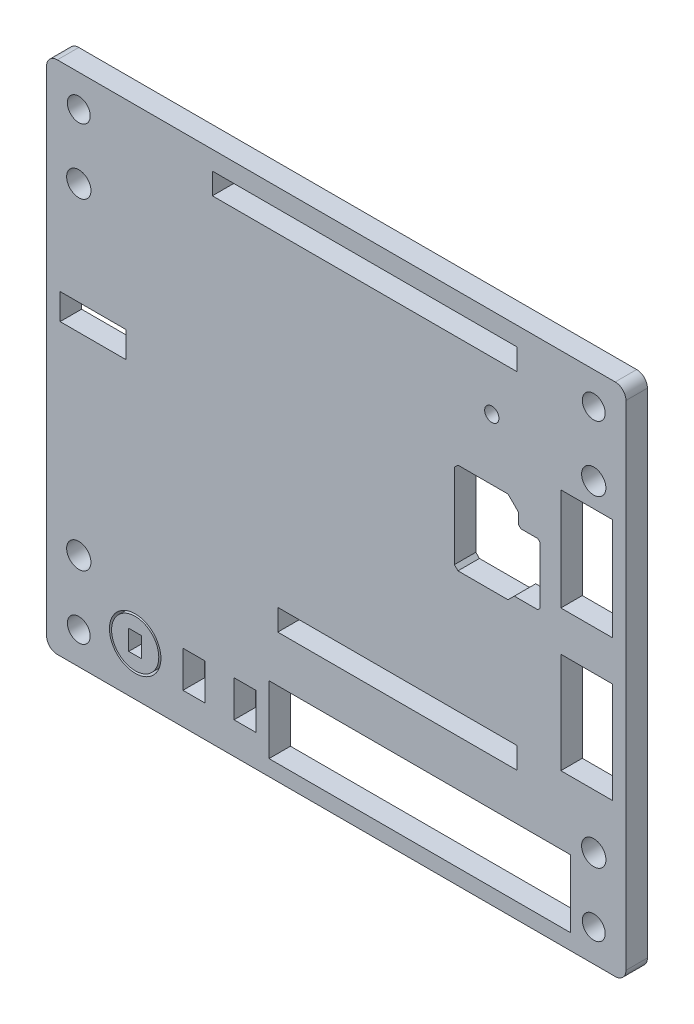
from build123d import *

# Parameters (mm, degrees)
MODEL_R                   = 1.600279216
MODEL_R_2                 = 3.6
MODEL_R_3                 = 1.7
MODEL_W                   = 3.1
MODEL_H                   = 5.1
MODEL_W_2                 = 33.477610829
MODEL_H_2                 = 3
MODEL_W_3                 = 7.19993206
MODEL_H_3                 = 14.105297
MODEL_H_4                 = 14.305297001
MODEL_W_4                 = 42.625961549
MODEL_R_4                 = 1
SALIENTE_EXTRUIR1_DEPTH   = 3
MODEL_R_5                 = 3.3
MODEL_W_5                 = 1.8
MODEL_H_5                 = 2.8
SALIENTE_EXTRUIR1_2_DEPTH = 3


with BuildPart() as part:
    # Model → Saliente-Extruir1 (new body)
    with BuildSketch(Plane.XY):
        with BuildLine():
            ThreePointArc((141.268153306, -46.554934941), (140.828813478, -45.494274769), (139.768153306, -45.054934941))
            Line((139.768153306, -45.054934941), (61.763543448, -45.054934941))
            ThreePointArc((61.763543448, -45.054934941), (60.702883276, -45.494274769), (60.263543448, -46.554934941))
            Line((60.263543448, -46.554934941), (60.263543448, -115.557339175))
            ThreePointArc((60.263543448, -115.557339175), (60.702883276, -116.617999347), (61.763543448, -117.057339175))
            Line((61.763543448, -117.057339175), (139.768153306, -117.057339175))
            ThreePointArc((139.768153306, -117.057339175), (140.828813478, -116.617999347), (141.268153306, -115.557339175))
            Line((141.268153306, -115.557339175), (141.268153306, -46.554934941))
        make_face()
        with Locations((64.763543448, -112.557673677)):
            Circle(MODEL_R, mode=Mode.SUBTRACT)
        with Locations((72.648093746, -110.294421642)):
            Circle(MODEL_R_2, mode=Mode.SUBTRACT)
        with Locations((64.763543448, -103.558008179)):
            Circle(MODEL_R_3, mode=Mode.SUBTRACT)
        with Locations((80.876831082, -110.067080389)):
            Rectangle(MODEL_W, MODEL_H, mode=Mode.SUBTRACT)
        with Locations((88.022204789, -110.067080389)):
            Rectangle(MODEL_W, MODEL_H, mode=Mode.SUBTRACT)
        Polygon((133.488780706, -114.868405375), (91.361604845, -114.869675438), (91.361604845, -105.439698172), (133.488780706, -105.438428109), align=None, mode=Mode.SUBTRACT)
        with Locations((136.768487808, -112.557673677)):
            Circle(MODEL_R, mode=Mode.SUBTRACT)
        with Locations((136.768487808, -103.558008179)):
            Circle(MODEL_R_3, mode=Mode.SUBTRACT)
        with Locations((109.323020283, -97.443925522)):
            Rectangle(MODEL_W_2, MODEL_H_2, mode=Mode.SUBTRACT)
        with Locations((135.766408204, -88.877958573)):
            Rectangle(MODEL_W_3, MODEL_H_3, mode=Mode.SUBTRACT)
        Polygon((71.39528321, -72.915924132), (71.39528321, -76.559558928), (62.152822733, -76.557988576), (62.152822733, -72.915924132), align=None, mode=Mode.SUBTRACT)
        with Locations((64.763543448, -58.554600438)):
            Circle(MODEL_R_3, mode=Mode.SUBTRACT)
        with Locations((64.763543448, -49.554934941)):
            Circle(MODEL_R, mode=Mode.SUBTRACT)
        Polygon((117.280814174, -66.624021947), (117.780814174, -66.124021947), (124.780814174, -66.124021947), (126.280814174, -67.624021947), (126.280814174, -69.133016861), (126.580814174, -69.433016861), (128.940476156, -69.433016861), (129.240476156, -69.733016861), (129.240476156, -77.746209187), (128.940476156, -78.046209187), (125.658626934, -78.046209187), (124.780814174, -78.924021947), (117.780814174, -78.924021947), (117.280814174, -78.424021947), align=None, mode=Mode.SUBTRACT)
        with Locations((135.766408204, -69.072591195)):
            Rectangle(MODEL_W_3, MODEL_H_4, mode=Mode.SUBTRACT)
        with Locations((104.752742978, -49.181536457)):
            Rectangle(MODEL_W_4, MODEL_H_2, mode=Mode.SUBTRACT)
        with Locations((122.513302154, -57.596973034)):
            Circle(MODEL_R_4, mode=Mode.SUBTRACT)
        with Locations((136.768487808, -58.554600438)):
            Circle(MODEL_R_3, mode=Mode.SUBTRACT)
        with Locations((136.768487808, -49.554934941)):
            Circle(MODEL_R, mode=Mode.SUBTRACT)
    extrude(amount=SALIENTE_EXTRUIR1_DEPTH)


with BuildPart() as body_2:
    # Model → Saliente-Extruir1 2 (new body)
    with BuildSketch(Plane.XY):
        with Locations((72.648093746, -110.294421642)):
            Circle(MODEL_R_5)
        with Locations((72.648093746, -110.294421642)):
            Rectangle(MODEL_W_5, MODEL_H_5, mode=Mode.SUBTRACT)
    extrude(amount=SALIENTE_EXTRUIR1_2_DEPTH)


solid = Compound([part.part, body_2.part])
